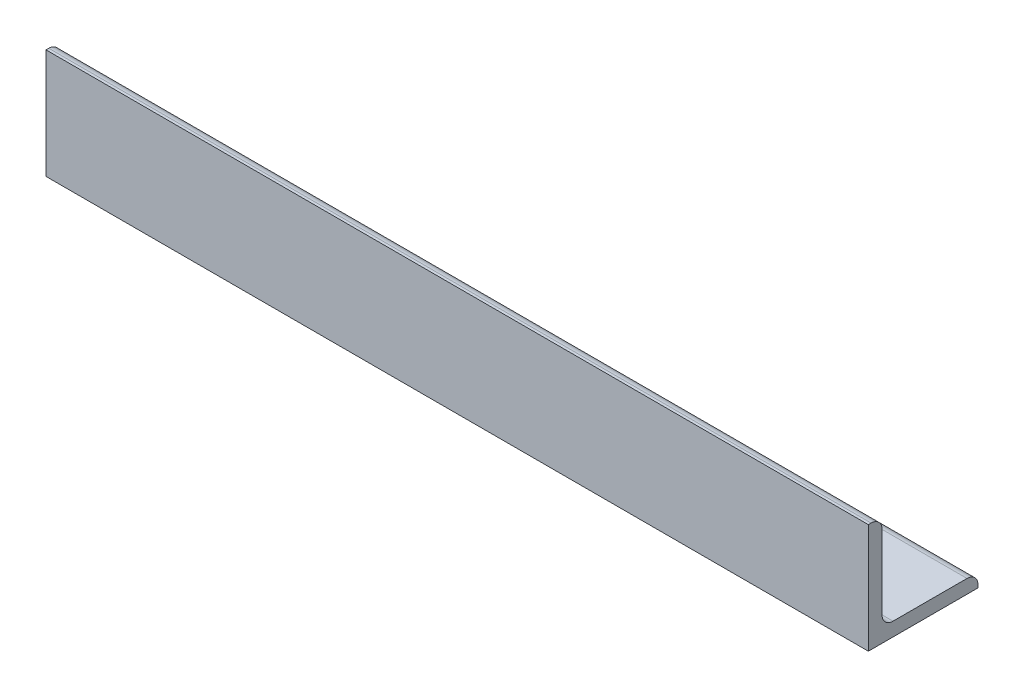
from build123d import *

# Parameters (mm, degrees)
BOSS_EXTRUDE1_DEPTH = 190.5


with BuildPart() as part:
    # Sketch1 → Boss-Extrude1 (new body)
    with BuildSketch(Plane(origin=(0, 0, 0), x_dir=(0, 0, -1), z_dir=(1, 0, 0))):
        with BuildLine():
            Line((0, 0), (0, 25.4))
            Line((0, 25.4), (0.635, 25.4))
            ThreePointArc((0.635, 25.4), (2.431051224, 24.656051224), (3.175, 22.86))
            Line((3.175, 22.86), (3.175, 5.715))
            ThreePointArc((3.175, 5.715), (3.918948776, 3.918948776), (5.715, 3.175))
            Line((5.715, 3.175), (22.86, 3.175))
            ThreePointArc((22.86, 3.175), (24.656051224, 2.431051224), (25.4, 0.635))
            Line((25.4, 0.635), (25.4, 0))
            Line((25.4, 0), (0, 0))
        make_face()
    extrude(amount=BOSS_EXTRUDE1_DEPTH)


solid = part.part
